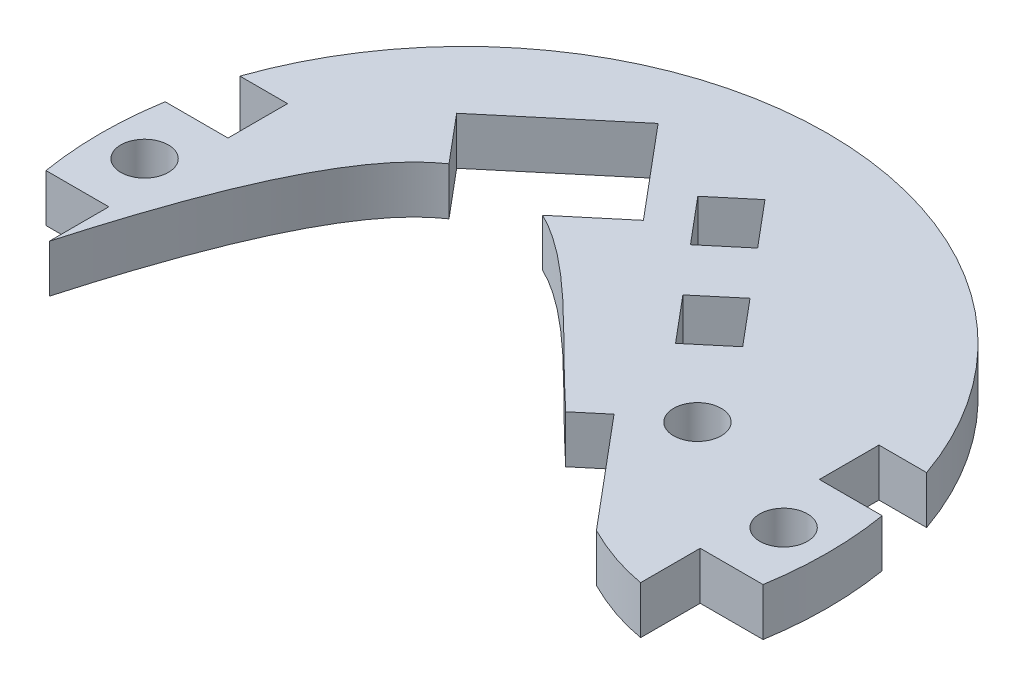
from build123d import *

# Parameters (mm, degrees)
CROQUIS1_R              = 30.5
SALIENTE_EXTRUIR1_DEPTH = 4
CROQUIS2_R              = 2
CORTAR_EXTRUIR1_DEPTH   = 4
CORTAR_EXTRUIR3_START   = -4
CORTAR_EXTRUIR3_DEPTH   = 4
CORTAR_EXTRUIR5_START   = -4
CROQUIS7_R              = 2
CORTAR_EXTRUIR5_DEPTH   = 4
CORTAR_EXTRUIR6_DEPTH   = 10
CROQUIS10_R             = 2
CORTAR_EXTRUIR7_DEPTH   = 4


with BuildPart() as part:
    # Croquis1 → Saliente-Extruir1 (new body)
    with BuildSketch(Plane(origin=(0, 0, 0), x_dir=(1, 0, 0), z_dir=(0, 1, 0))):
        with Locations(Location((0, 0, 0), (0, 0, 270))):
            Circle(CROQUIS1_R)
    extrude(amount=SALIENTE_EXTRUIR1_DEPTH)

    # Croquis2 → Cortar-Extruir1 (cut)
    with BuildSketch(Plane(origin=(0, 4, 0), x_dir=(1, 0, 0), z_dir=(0, 1, 0))):
        with Locations(Location((0, 0, 0), (0, 0, 270))):
            Circle(CROQUIS2_R)
    extrude(amount=-CORTAR_EXTRUIR1_DEPTH, mode=Mode.SUBTRACT)

    # Croquis5 → Cortar-Extruir3 (cut)
    with BuildSketch(Plane(origin=(0, 4, 0), x_dir=(1, 0, 0), z_dir=(0, 1, 0)).offset(CORTAR_EXTRUIR3_START)):
        with BuildLine():
            Line((28.814059068, 5), (30.087372767, 5))
            ThreePointArc((30.087372767, 5), (29.556634924, 7.526973624), (28.814059068, 10))
            Line((28.814059068, 10), (24.814059068, 10))
            Line((24.814059068, 10), (24.814059068, 5))
            Line((24.814059068, 5), (28.814059068, 5))
        make_face()
        with BuildLine():
            Line((30.087372767, -5), (28.814059068, -5))
            Line((28.814059068, -5), (24.814059068, -5))
            Line((24.814059068, -5), (24.814059068, -10))
            Line((24.814059068, -10), (28.814059068, -10))
            ThreePointArc((28.814059068, -10), (29.556634924, -7.526973624), (30.087372767, -5))
        make_face()
        with BuildLine():
            Line((-24.814059068, 5), (-24.814059068, 10))
            Line((-24.814059068, 10), (-28.814059068, 10))
            ThreePointArc((-28.814059068, 10), (-29.556634924, 7.526973624), (-30.087372767, 5))
            Line((-30.087372767, 5), (-28.814059068, 5))
            Line((-28.814059068, 5), (-24.814059068, 5))
        make_face()
        with BuildLine():
            Line((-28.814059068, -10), (-24.814059068, -10))
            Line((-24.814059068, -10), (-24.814059068, -5))
            Line((-24.814059068, -5), (-28.814059068, -5))
            Line((-28.814059068, -5), (-30.087372767, -5))
            ThreePointArc((-30.087372767, -5), (-29.556634924, -7.526973624), (-28.814059068, -10))
        make_face()
    extrude(amount=CORTAR_EXTRUIR3_DEPTH, mode=Mode.SUBTRACT)

    # Croquis7 → Cortar-Extruir5 (cut)
    with BuildSketch(Plane(origin=(0, 4, 0), x_dir=(1, 0, 0), z_dir=(0, 1, 0)).offset(CORTAR_EXTRUIR5_START)):
        with Locations(Location((15.526809242, 4.053864794, 0), (0, 0, 270))):
            Circle(CROQUIS7_R)
        Polygon((2.194434654, 23.054217761), (-0.869743118, 20.483067322), (2.34419493, 16.652845106), (5.408372702, 19.223995545), align=None)
        with BuildLine():
            Line((-24.814059068, -10), (-28.814059068, -10))
            ThreePointArc((-28.814059068, -10), (0, -30.5), (28.814059068, -10))
            Line((28.814059068, -10), (24.814059068, -10))
            add(Edge.make_bspline(
                [(24.814059068, -10), (22.863263717, -9.657344338), (20.984021298, -8.980450277), (19.168992989, -8.065339906)],
                knots=[0, 0, 0, 0, 0.087850084, 0.087850084, 0.087850084, 0.087850084], degree=3))
            Line((19.168992989, -8.065339906), (11.455541673, 1.127193412))
            Line((11.455541673, 1.127193412), (9.248678515, -0.72458465))
            add(Edge.make_bspline(
                [(9.248678515, -0.72458465), (3.657558626, 4.465361799), (-1.318373357, 10.288134416), (-5.99647718, 12.591356616)],
                knots=[0.258799312, 0.258799312, 0.258799312, 0.258799312, 0.567154107, 0.567154107, 0.567154107, 0.567154107], degree=3))
            Line((-5.99647718, 12.591356616), (-1.400210521, 16.448082274))
            Line((-1.400210521, 16.448082274), (-7.828086618, 24.108526705))
            Line((-7.828086618, 24.108526705), (-17.020619935, 16.395075389))
            Line((-17.020619935, 16.395075389), (-13.66601447, 12.397212273))
            add(Edge.make_bspline(
                [(-13.66601447, 12.397212273), (-17.403465693, 9.897923685), (-21.056529869, 3.255841362), (-24.814059068, -10)],
                knots=[0.740637404, 0.740637404, 0.740637404, 0.740637404, 1, 1, 1, 1], degree=3))
        make_face()
    extrude(amount=CORTAR_EXTRUIR5_DEPTH, mode=Mode.SUBTRACT)

    # Croquis9 → Cortar-Extruir6 (cut)
    with BuildSketch(Plane(origin=(0, 4, 0), x_dir=(1, 0, 0), z_dir=(0, 1, 0))):
        Polygon((8.737462625, 15.25654067), (5.673284852, 12.685390231), (8.887222901, 8.855168016), (11.951400673, 11.426318455), align=None)
    extrude(amount=-CORTAR_EXTRUIR6_DEPTH, mode=Mode.SUBTRACT)

    # Croquis10 → Cortar-Extruir7 (cut)
    with BuildSketch(Plane(origin=(0, 4, 0), x_dir=(1, 0, 0), z_dir=(0, 1, 0))):
        with Locations(Location((-26.814059068, 0, 0), (0, 0, 270))):
            Circle(CROQUIS10_R)
        with Locations(Location((26.814059068, 0, 0), (0, 0, 270))):
            Circle(CROQUIS10_R)
    extrude(amount=-CORTAR_EXTRUIR7_DEPTH, mode=Mode.SUBTRACT)


solid = part.part
